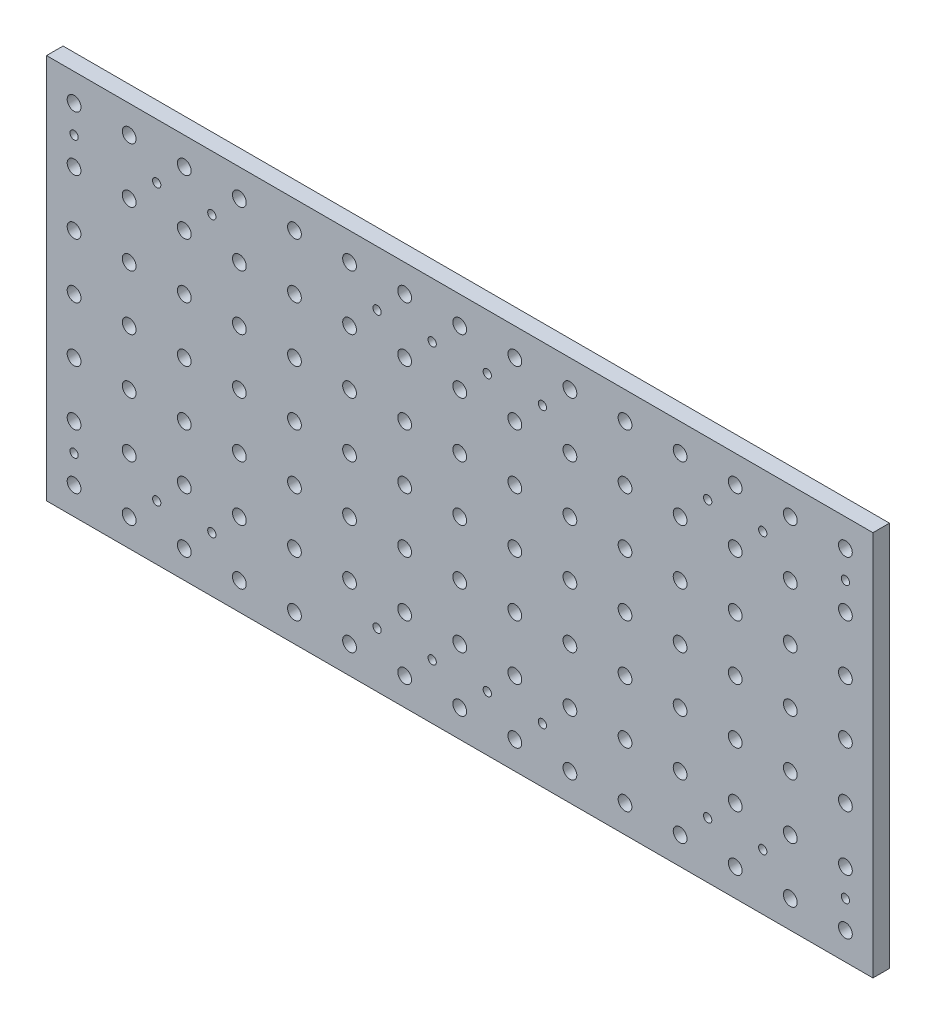
from build123d import *

# Parameters (mm, degrees)
SKIZZE1_W                       = 300
SKIZZE1_H                       = 140
AUFSATZ_LINEAR_AUSTRAGEN2_DEPTH = 6
SKIZZE2_R                       = 2.5
SCHNITT_LINEAR_AUSTRAGEN1_DEPTH = 6
LINEARES_MUSTER1_COUNT          = 15
LINEARES_MUSTER1_PITCH          = 20
LINEARES_MUSTER1_COUNT_DIR2     = 7
LINEARES_MUSTER1_PITCH_DIR2     = 20
SKIZZE5_R                       = 1.5
SCHNITT_LINEAR_AUSTRAGEN3_DEPTH = 10
SKIZZE4_R                       = 1.51
CORTAR_EXTRUIR1_DEPTH           = 10
MATRIZL1_COUNT                  = 2
MATRIZL1_PITCH                  = 100
MATRIZL1_COUNT_DIR2             = 2
MATRIZL1_PITCH_DIR2             = 20
MATRIZL2_COUNT                  = 2
MATRIZL2_PITCH                  = 100
MATRIZL2_COUNT_DIR2             = 2
MATRIZL2_PITCH_DIR2             = 280
CROQUIS1_R                      = 1.5
CORTAR_EXTRUIR2_DEPTH           = 10
MATRIZL3_COUNT                  = 2
MATRIZL3_PITCH                  = 100
MATRIZL3_COUNT_DIR2             = 2
MATRIZL3_PITCH_DIR2             = 20
CROQUIS2_R                      = 1.5
CORTAR_EXTRUIR3_DEPTH           = 10
MATRIZL4_COUNT                  = 4
MATRIZL4_PITCH                  = 20
MATRIZL4_COUNT_DIR2             = 2
MATRIZL4_PITCH_DIR2             = 100


with BuildPart() as part:
    # Skizze1 → Aufsatz-Linear austragen2 (new body)
    with BuildSketch(Plane.XY):
        Rectangle(SKIZZE1_W, SKIZZE1_H)
    extrude(amount=AUFSATZ_LINEAR_AUSTRAGEN2_DEPTH)

    # Skizze2 → Schnitt-Linear austragen1 (cut)
    with BuildSketch(Plane(origin=(0, 0, 0), x_dir=(-1, 0, 0), z_dir=(0, 0, -1))):
        with Locations((-140, 60)):
            Circle(SKIZZE2_R)
    schnitt_linear_austragen1 = extrude(amount=-SCHNITT_LINEAR_AUSTRAGEN1_DEPTH, mode=Mode.SUBTRACT)

    # Lineares Muster1: Schnitt-Linear austragen1 15 × 7
    with Locations(*[(-i * LINEARES_MUSTER1_PITCH, -j * LINEARES_MUSTER1_PITCH_DIR2, 0) for i in range(LINEARES_MUSTER1_COUNT) for j in range(LINEARES_MUSTER1_COUNT_DIR2) if (i, j) != (0, 0)]):
        add(schnitt_linear_austragen1, mode=Mode.SUBTRACT)

    # Skizze5 → Schnitt-Linear austragen3 (cut)
    with BuildSketch(Plane(origin=(0, 0, 0), x_dir=(-1, 0, 0), z_dir=(0, 0, -1))):
        with Locations((-140, 50)):
            Circle(SKIZZE5_R)
    schnitt_linear_austragen3 = extrude(amount=-SCHNITT_LINEAR_AUSTRAGEN3_DEPTH, mode=Mode.SUBTRACT)

    # Skizze4 → Cortar-Extruir1 (cut)
    with BuildSketch(Plane(origin=(0, 0, 0), x_dir=(-1, 0, 0), z_dir=(0, 0, -1))):
        with Locations((-110, 50.3739212)):
            Circle(SKIZZE4_R)
    cortar_extruir1 = extrude(amount=-CORTAR_EXTRUIR1_DEPTH, mode=Mode.SUBTRACT)

    # MatrizL1: Cortar-Extruir1 2 × 2
    with Locations(*[(-j * MATRIZL1_PITCH_DIR2, -i * MATRIZL1_PITCH, 0) for i in range(MATRIZL1_COUNT) for j in range(MATRIZL1_COUNT_DIR2) if (i, j) != (0, 0)]):
        add(cortar_extruir1, mode=Mode.SUBTRACT)

    # MatrizL2: Schnitt-Linear austragen3 2 × 2
    with Locations(*[(-j * MATRIZL2_PITCH_DIR2, -i * MATRIZL2_PITCH, 0) for i in range(MATRIZL2_COUNT) for j in range(MATRIZL2_COUNT_DIR2) if (i, j) != (0, 0)]):
        add(schnitt_linear_austragen3, mode=Mode.SUBTRACT)

    # Croquis1 → Cortar-Extruir2 (cut)
    with BuildSketch(Plane(origin=(0, 0, 0), x_dir=(-1, 0, 0), z_dir=(0, 0, -1))):
        with Locations((110, 50)):
            Circle(CROQUIS1_R)
    cortar_extruir2 = extrude(amount=-CORTAR_EXTRUIR2_DEPTH, mode=Mode.SUBTRACT)

    # MatrizL3: Cortar-Extruir2 2 × 2
    with Locations(*[(j * MATRIZL3_PITCH_DIR2, -i * MATRIZL3_PITCH, 0) for i in range(MATRIZL3_COUNT) for j in range(MATRIZL3_COUNT_DIR2) if (i, j) != (0, 0)]):
        add(cortar_extruir2, mode=Mode.SUBTRACT)

    # Croquis2 → Cortar-Extruir3 (cut)
    with BuildSketch(Plane(origin=(0, 0, 0), x_dir=(-1, 0, 0), z_dir=(0, 0, -1))):
        with Locations((30, 50)):
            Circle(CROQUIS2_R)
    cortar_extruir3 = extrude(amount=-CORTAR_EXTRUIR3_DEPTH, mode=Mode.SUBTRACT)

    # MatrizL4: Cortar-Extruir3 4 × 2
    with Locations(*[(i * MATRIZL4_PITCH, -j * MATRIZL4_PITCH_DIR2, 0) for i in range(MATRIZL4_COUNT) for j in range(MATRIZL4_COUNT_DIR2) if (i, j) != (0, 0)]):
        add(cortar_extruir3, mode=Mode.SUBTRACT)


solid = part.part
